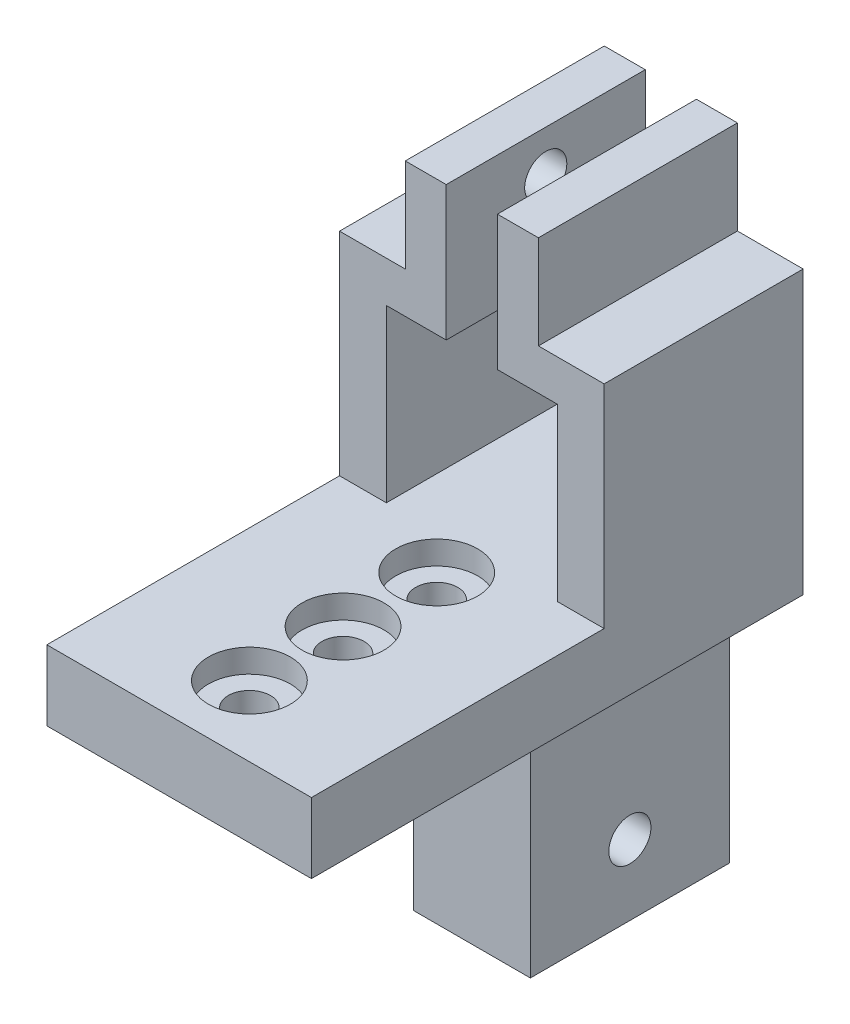
from build123d import *

# Parameters (mm, degrees)
BOSS_EXTRUDE1_DEPTH = 17
SKETCH3_W           = 10
SKETCH3_H           = 23
BOSS_EXTRUDE2_DEPTH = 17
SKETCH4_R           = 1.8
CUT_EXTRUDE1_DEPTH  = 42.475618626
SKETCH5_W           = 22.6
SKETCH5_H           = 6
BOSS_EXTRUDE3_DEPTH = 25
SKETCH6_R           = 1.8
CUT_EXTRUDE2_DEPTH  = 53.324521174
SKETCH7_R           = 3.5
CUT_EXTRUDE3_DEPTH  = 2


with BuildPart() as part:
    # Sketch2 → Boss-Extrude1 (new body)
    with BuildSketch(Plane.XY):
        Polygon((-7.526296722, 9.460038951), (-7.526296722, -5.139961049), (7.073703278, -5.139961049), (7.073703278, 9.460038951), (1.960317302, 9.460038951), (1.960317302, 20.960038951), (5.460317302, 20.960038951), (5.460317302, 12.960038951), (11.073703278, 12.960038951), (11.073703278, -11.139961049), (-11.526296722, -11.139961049), (-11.526296722, 12.960038951), (-5.912910746, 12.960038951), (-5.912910746, 20.960038951), (-2.412910746, 20.960038951), (-2.412910746, 9.460038951), align=None)
    extrude(amount=BOSS_EXTRUDE1_DEPTH)

    # Sketch3 → Boss-Extrude2 (add)
    with BuildSketch(Plane.XY.offset(17)):
        with Locations((-0.226296722, -22.639961049)):
            Rectangle(SKETCH3_W, SKETCH3_H)
    extrude(amount=-BOSS_EXTRUDE2_DEPTH)

    # Sketch4 → Cut-Extrude1 (cut, through all)
    with BuildSketch(Plane(origin=(4.773703278, 0, 0), x_dir=(0, 0, -1), z_dir=(1, 0, 0))):
        with Locations(Location((-8.5, -28.139961049, 0), (0, 0, 90))):
            Circle(SKETCH4_R)
        with Locations(Location((-8.5, 17.360038951, 0), (0, 0, 90))):
            Circle(SKETCH4_R)
    extrude(amount=-CUT_EXTRUDE1_DEPTH, mode=Mode.SUBTRACT)

    # Sketch5 → Boss-Extrude3 (add)
    with BuildSketch(Plane.XY.offset(17)):
        with Locations((-0.226296722, -8.139961049)):
            Rectangle(SKETCH5_W, SKETCH5_H)
    extrude(amount=BOSS_EXTRUDE3_DEPTH)

    # Sketch6 → Cut-Extrude2 (cut, through all)
    with BuildSketch(Plane(origin=(0, -5.139961049, 0), x_dir=(1, 0, 0), z_dir=(0, 1, 0))):
        with Locations(Location((-0.226296722, -36, 0), (0, 0, 180))):
            Circle(SKETCH6_R)
        with Locations(Location((-0.226296722, -28, 0), (0, 0, 180))):
            Circle(SKETCH6_R)
        with Locations(Location((-0.226296722, -20, 0), (0, 0, 180))):
            Circle(SKETCH6_R)
    extrude(amount=-CUT_EXTRUDE2_DEPTH, mode=Mode.SUBTRACT)

    # Sketch7 → Cut-Extrude3 (cut)
    with BuildSketch(Plane(origin=(0, -5.139961049, 0), x_dir=(1, 0, 0), z_dir=(0, 1, 0))):
        with Locations(Location((-0.226296722, -36, 0), (0, 0, 180))):
            Circle(SKETCH7_R)
        with Locations(Location((-0.226296722, -28, 0), (0, 0, 180))):
            Circle(SKETCH7_R)
        with Locations(Location((-0.226296722, -20, 0), (0, 0, 180))):
            Circle(SKETCH7_R)
    extrude(amount=-CUT_EXTRUDE3_DEPTH, mode=Mode.SUBTRACT)


solid = part.part
